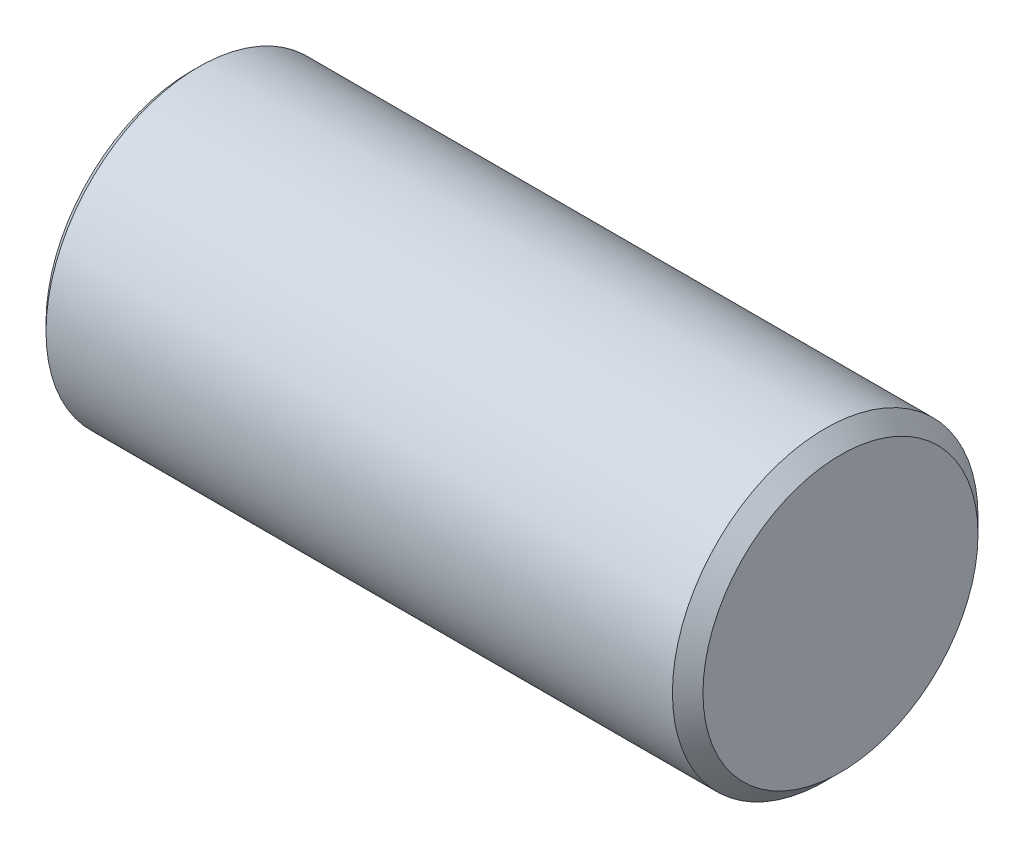
from build123d import *


with BuildPart() as part:
    # Эскиз1 → Повернуть1 (revolve)
    with BuildSketch(Plane(origin=(0, 0, 0), x_dir=(1, 0, 0), z_dir=(0, 1, 0))):
        Polygon((92.65287472, 0), (92.65287472, 18), (90.65287472, 20), (8.65287472, 20), (7.65287472, 19), (7.65287472, 14.750046626), (8.65287472, 13.750046626), (64.318317571, 13.750046626), (71.629429714, 0), align=None)
    revolve(axis=Axis((102.994030824, 0, 0), (-1, 0, 0)))


solid = part.part
